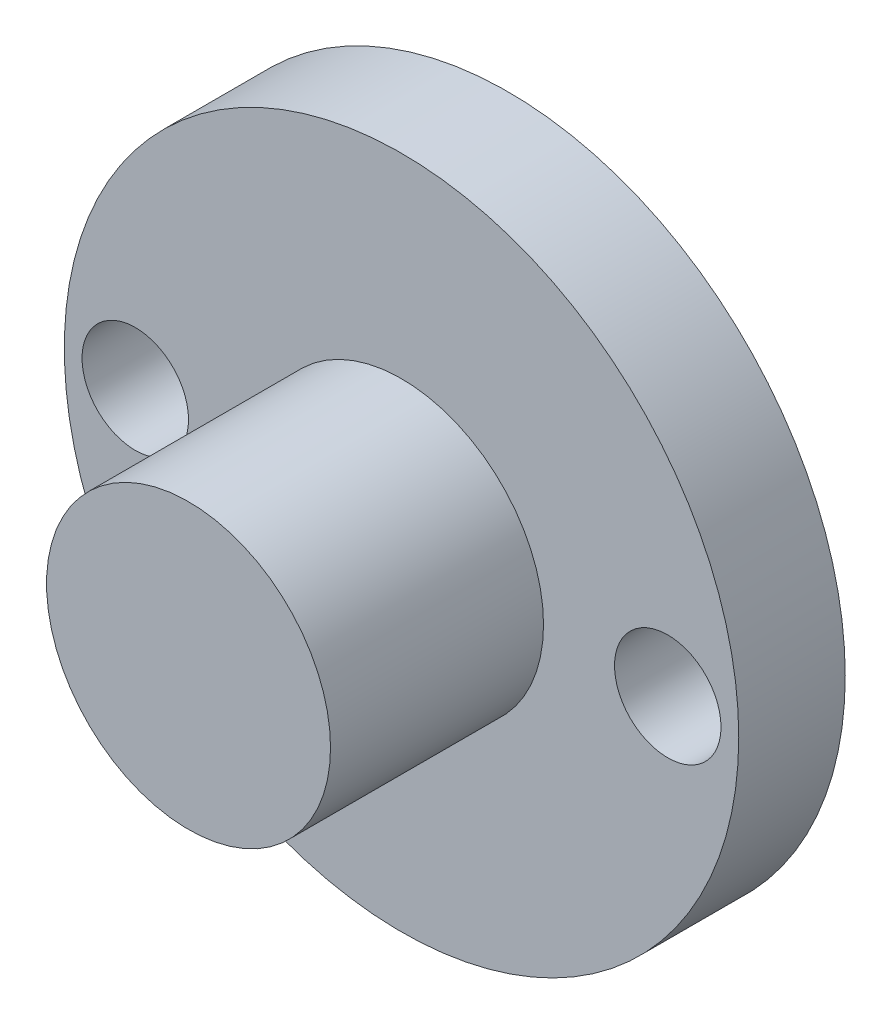
from build123d import *

# Parameters (mm, degrees)
CROQUIS1_R              = 9.5
SALIENTE_EXTRUIR1_DEPTH = 3
CROQUIS2_R              = 4
SALIENTE_EXTRUIR2_DEPTH = 6
CROQUIS3_R              = 2.5
SALIENTE_EXTRUIR3_DEPTH = 1.5
CROQUIS4_R              = 1.5
CORTAR_EXTRUIR1_DEPTH   = 15.71393897


with BuildPart() as part:
    # Croquis1 → Saliente-Extruir1 (new body)
    with BuildSketch(Plane.XY):
        Circle(CROQUIS1_R)
    extrude(amount=SALIENTE_EXTRUIR1_DEPTH)

    # Croquis2 → Saliente-Extruir2 (add)
    with BuildSketch(Plane.XY.offset(3)):
        Circle(CROQUIS2_R)
    extrude(amount=SALIENTE_EXTRUIR2_DEPTH)

    # Croquis3 → Saliente-Extruir3 (add)
    with BuildSketch(Plane(origin=(0, 0, 0), x_dir=(-1, 0, 0), z_dir=(0, 0, -1))):
        Circle(CROQUIS3_R)
    extrude(amount=SALIENTE_EXTRUIR3_DEPTH)

    # Croquis4 → Cortar-Extruir1 (cut, through all)
    with BuildSketch(Plane.XY.offset(3)):
        with Locations((-7.5, 0)):
            Circle(CROQUIS4_R)
        with Locations((7.5, 0)):
            Circle(CROQUIS4_R)
    extrude(amount=-CORTAR_EXTRUIR1_DEPTH, mode=Mode.SUBTRACT)


solid = part.part
